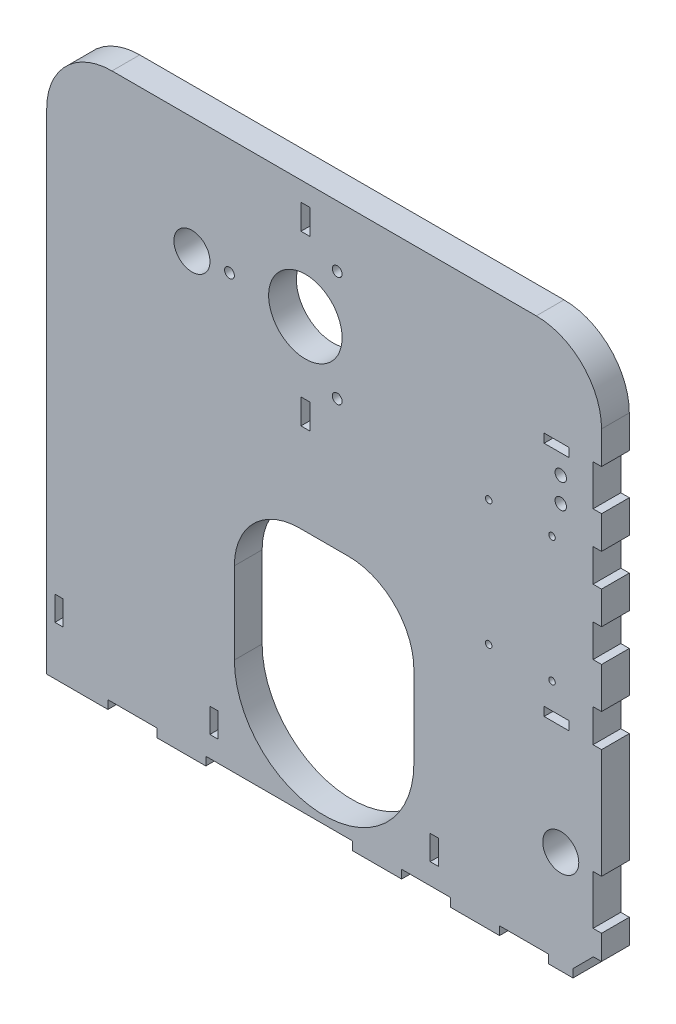
from build123d import *

# Parameters (mm, degrees)
MODEL_R             = 11.05
MODEL_R_2           = 22.5
MODEL_R_3           = 3
MODEL_R_4           = 3.5
MODEL_R_5           = 2
MODEL_W             = 5.4
MODEL_H             = 15.4
MODEL_W_2           = 5
MODEL_H_2           = 15
MODEL_W_3           = 15.4
MODEL_H_3           = 5.4
BOSS_EXTRUDE1_DEPTH = 17


with BuildPart() as part:
    # Model → Boss-Extrude1 (new body)
    with BuildSketch(Plane.XY):
        with BuildLine():
            Line((170.621850122, -313.319218198), (170.621850122, -293.319218198))
            Line((170.621850122, -293.319218198), (175.821850122, -293.319218198))
            Line((175.821850122, -293.319218198), (175.821850122, -273.319218198))
            Line((175.821850122, -273.319218198), (170.621850122, -273.319218198))
            Line((170.621850122, -273.319218198), (170.621850122, -253.319218198))
            Line((170.621850122, -253.319218198), (175.821850122, -253.319218198))
            Line((175.821850122, -253.319218198), (175.821850122, -233.319218198))
            Line((175.821850122, -233.319218198), (170.621850122, -233.319218198))
            Line((170.621850122, -233.319218198), (170.621850122, -208.319218198))
            Line((170.621850122, -208.319218198), (175.821850122, -208.319218198))
            Line((175.821850122, -208.319218198), (175.821850122, -188.319218198))
            ThreePointArc((175.821850122, -188.319218198), (164.106121369, -160.034946951), (135.821850122, -148.319218198))
            Line((135.821850122, -148.319218198), (-124.178149879, -148.319218198))
            ThreePointArc((-124.178149879, -148.319218198), (-152.462421126, -160.034946951), (-164.178149878, -188.319218198))
            Line((-164.178149878, -188.319218198), (-164.178149878, -488.469218198))
            Line((-164.178149878, -488.469218198), (-126.678149879, -488.469218198))
            Line((-126.678149879, -488.469218198), (-126.678149879, -483.269218198))
            Line((-126.678149879, -483.269218198), (-96.678149879, -483.269218198))
            Line((-96.678149879, -483.269218198), (-96.678149879, -488.469218198))
            Line((-96.678149879, -488.469218198), (-66.678149879, -488.469218198))
            Line((-66.678149879, -488.469218198), (-66.678149879, -483.269218198))
            Line((-66.678149879, -483.269218198), (23.321850122, -483.269218198))
            Line((23.321850122, -483.269218198), (23.321850122, -488.469218198))
            Line((23.321850122, -488.469218198), (53.321850122, -488.469218198))
            Line((53.321850122, -488.469218198), (53.321850122, -483.269218198))
            Line((53.321850122, -483.269218198), (83.321850122, -483.269218198))
            Line((83.321850122, -483.269218198), (83.321850122, -488.469218198))
            Line((83.321850122, -488.469218198), (113.321850122, -488.469218198))
            Line((113.321850122, -488.469218198), (113.321850122, -483.269218198))
            Line((113.321850122, -483.269218198), (143.321850122, -483.269218198))
            Line((143.321850122, -483.269218198), (143.321850122, -488.469218198))
            Line((143.321850122, -488.469218198), (158.321850122, -488.469218198))
            Line((158.321850122, -488.469218198), (158.321850122, -483.469218198))
            Line((158.321850122, -483.469218198), (170.821850122, -470.969218198))
            Line((170.821850122, -470.969218198), (175.821850122, -470.969218198))
            Line((175.821850122, -470.969218198), (175.821850122, -455.969218198))
            Line((175.821850122, -455.969218198), (170.621850122, -455.969218198))
            Line((170.621850122, -455.969218198), (170.621850122, -425.769218198))
            Line((170.621850122, -425.769218198), (175.821850122, -425.769218198))
            Line((175.821850122, -425.769218198), (175.821850122, -358.519218198))
            Line((175.821850122, -358.519218198), (170.621850122, -358.519218198))
            Line((170.621850122, -358.519218198), (170.621850122, -338.319218198))
            Line((170.621850122, -338.319218198), (175.821850122, -338.319218198))
            Line((175.821850122, -338.319218198), (175.821850122, -313.319218198))
            Line((175.821850122, -313.319218198), (170.621850122, -313.319218198))
        make_face()
        with Locations((-75.178149879, -219.469218198)):
            Circle(MODEL_R, mode=Mode.SUBTRACT)
        with Locations((150.821850122, -425.469218198)):
            Circle(MODEL_R, mode=Mode.SUBTRACT)
        with Locations((-5.678149878, -219.469218198)):
            Circle(MODEL_R_2, mode=Mode.SUBTRACT)
        with Locations((13.821850122, -253.244208946)):
            Circle(MODEL_R_3, mode=Mode.SUBTRACT)
        with Locations((13.821850122, -185.69422745)):
            Circle(MODEL_R_3, mode=Mode.SUBTRACT)
        with Locations((-52.178149879, -219.469218198)):
            Circle(MODEL_R_3, mode=Mode.SUBTRACT)
        with Locations((150.821850122, -240.469218198)):
            Circle(MODEL_R_4, mode=Mode.SUBTRACT)
        with Locations((150.821850122, -225.469218198)):
            Circle(MODEL_R_4, mode=Mode.SUBTRACT)
        with Locations((106.671850121, -337.269218198)):
            Circle(MODEL_R_5, mode=Mode.SUBTRACT)
        with Locations((145.471850121, -260.469218198)):
            Circle(MODEL_R_5, mode=Mode.SUBTRACT)
        with Locations((145.471850121, -337.269218198)):
            Circle(MODEL_R_5, mode=Mode.SUBTRACT)
        with Locations((106.671850121, -260.469218198)):
            Circle(MODEL_R_5, mode=Mode.SUBTRACT)
        with BuildLine():
            Line((-49.178149879, -373.469218198), (-49.178149878, -423.469218198))
            ThreePointArc((-49.178149878, -423.469218198), (5.821850122, -478.469218198), (60.821850122, -423.469218198))
            Line((60.821850122, -423.469218198), (60.821850122, -373.469218198))
            ThreePointArc((60.821850122, -373.469218198), (49.106121369, -345.184946951), (20.821850122, -333.469218198))
            Line((20.821850122, -333.469218198), (-9.178149878, -333.469218198))
            ThreePointArc((-9.178149878, -333.469218198), (-37.462421126, -345.184946951), (-49.178149879, -373.469218198))
        make_face(mode=Mode.SUBTRACT)
        with Locations((-5.678149879, -167.819218198)):
            Rectangle(MODEL_W, MODEL_H, mode=Mode.SUBTRACT)
        with Locations((-5.678149879, -271.119218198)):
            Rectangle(MODEL_W, MODEL_H, mode=Mode.SUBTRACT)
        with Locations((73.321850122, -462.969218198)):
            Rectangle(MODEL_W_2, MODEL_H_2, mode=Mode.SUBTRACT)
        with Locations((148.321850122, -210.819218198)):
            Rectangle(MODEL_W_3, MODEL_H_3, mode=Mode.SUBTRACT)
        with Locations((148.321850122, -355.819218198)):
            Rectangle(MODEL_W_3, MODEL_H_3, mode=Mode.SUBTRACT)
        with Locations((-156.678149878, -450.969218198)):
            Rectangle(MODEL_W_2, MODEL_H_2, mode=Mode.SUBTRACT)
        with Locations((-61.678149878, -462.969218198)):
            Rectangle(MODEL_W_2, MODEL_H_2, mode=Mode.SUBTRACT)
    extrude(amount=BOSS_EXTRUDE1_DEPTH)


solid = part.part
